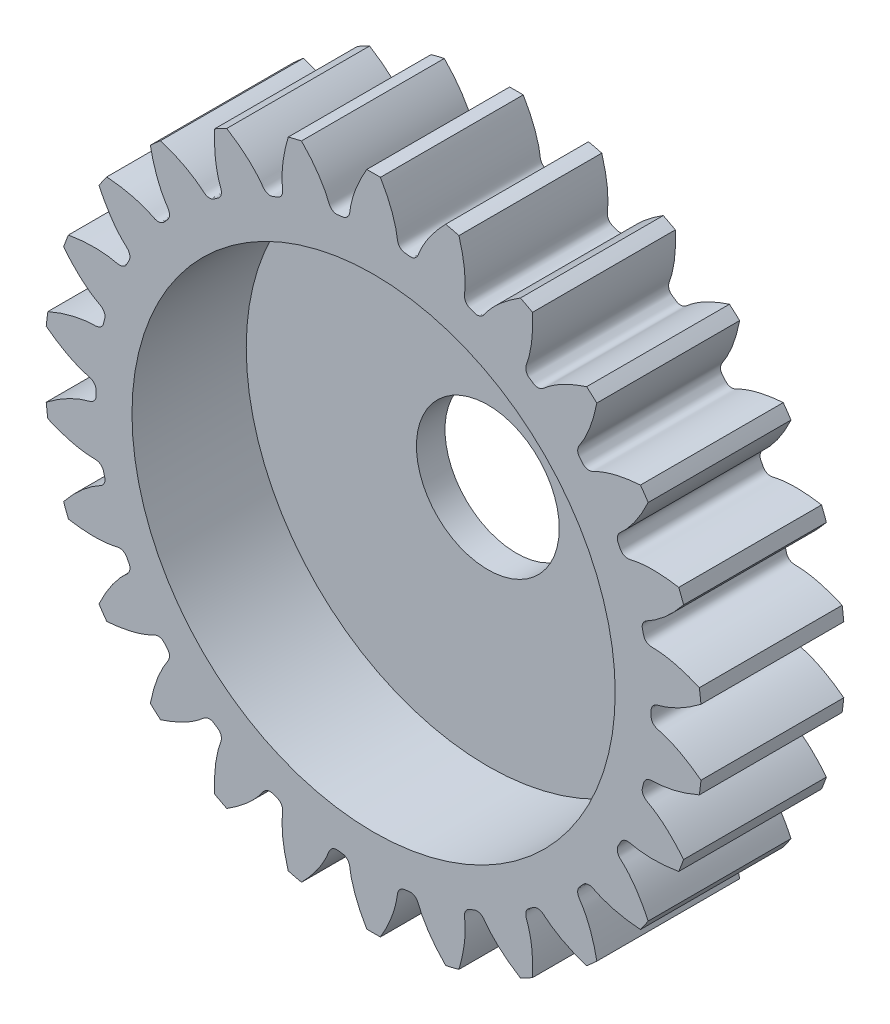
from build123d import *

# Parameters (mm, degrees)
SKETCHREVOLVESPURASSEMBLYNEW2PINION_W       = 6
SKETCHREVOLVESPURASSEMBLYNEW2PINION_H       = 13.822115385
TOOTHEXTRUDECUTSPURASSEMBLYNEW2PINION_DEPTH = 4
PATTERNSPURASSEMBLYNEW2PINION_COUNT         = 26
SKETCH_2_R                                  = 10.15
CUT_EXTRUDE_2_DEPTH                         = 4.8
SKETCH_4_R                                  = 3
CUT_EXTRUDE_3_DEPTH                         = 21.080697223


with BuildPart() as part:
    # SketchRevolveSpurAssemblyNew2Pinion → SpurAssemblyNew2Pinion (revolve)
    with BuildSketch(Plane(origin=(0, 0, 0), x_dir=(0, 0, -1), z_dir=(1, 0, 0))):
        with Locations((-1, 6.911057693)):
            Rectangle(SKETCHREVOLVESPURASSEMBLYNEW2PINION_W, SKETCHREVOLVESPURASSEMBLYNEW2PINION_H)
    revolve(axis=Axis((0, 0, 0), (0, 0, -1)))

    # SketchToothSpurAssemblyNew2Pinion → ToothExtrudeCutSpurAssemblyNew2Pinion (cut, symmetric)
    with BuildSketch(Plane.XY):
        with BuildLine():
            ThreePointArc((13.81451757, 1.428912571), (13.888221154, 0), (13.81451757, -1.428912571))
            add(Edge.make_bspline(
                [(13.81451757, -1.428912571), (13.726688541, -1.359920515), (13.595197672, -1.261341012), (13.418856258, -1.138772461), (13.292585484, -1.055332348), (13.169877801, -0.978321954), (13.050962499, -0.907526114), (12.936060688, -0.842722426), (12.825385077, -0.783681639), (12.719139799, -0.730167838), (12.617520148, -0.681938938), (12.520712627, -0.638746252), (12.428893992, -0.600337203), (12.342233738, -0.566447419), (12.260885006, -0.536828638), (12.185014321, -0.511156667), (12.114702314, -0.489338003), (12.027112004, -0.463735243), (11.954138744, -0.448230597), (11.897794168, -0.427981043), (11.875856753, -0.418994985), (11.853410983, -0.408473503), (11.830202837, -0.395946023), (11.805975271, -0.380738879), (11.780539315, -0.361904625), (11.753919073, -0.33815527), (11.726633215, -0.307873546), (11.700089703, -0.269352659), (11.677071777, -0.221496801), (11.661562379, -0.16645758), (11.656168867, -0.09130535), (11.660269272, 0), (11.656168867, 0.09130535), (11.661562379, 0.16645758), (11.677071777, 0.221496801), (11.700089703, 0.269352659), (11.726633215, 0.307873546), (11.753919073, 0.33815527), (11.780539315, 0.361904625), (11.805975271, 0.380738879), (11.830202837, 0.395946023), (11.853410983, 0.408473503), (11.875856753, 0.418994985), (11.897794168, 0.427981043), (11.954138744, 0.448230597), (12.027112004, 0.463735243), (12.114702314, 0.489338003), (12.185014321, 0.511156667), (12.260885006, 0.536828638), (12.342233738, 0.566447419), (12.428893992, 0.600337203), (12.520712627, 0.638746252), (12.617520148, 0.681938938), (12.719139799, 0.730167838), (12.825385077, 0.783681639), (12.936060688, 0.842722426), (13.050962499, 0.907526114), (13.169877801, 0.978321954), (13.292585484, 1.055332348), (13.418856258, 1.138772461), (13.595197672, 1.261341012), (13.726688541, 1.359920515), (13.81451757, 1.428912571)],
                knots=[0, 0, 0, 0, 0.061765594, 0.090857399, 0.118755208, 0.145459022, 0.170968841, 0.195284665, 0.218406493, 0.240334327, 0.261068165, 0.280608009, 0.298953857, 0.31610571, 0.332063567, 0.34682743, 0.360397297, 0.37277317, 0.397298679, 0.401522405, 0.405867911, 0.410405301, 0.415225201, 0.420444455, 0.426211586, 0.432708636, 0.440141309, 0.448702283, 0.458489871, 0.469387514, 0.480099546, 0.5, 0.519900454, 0.530612486, 0.541510129, 0.551297717, 0.559858691, 0.567291364, 0.573788414, 0.579555545, 0.584774799, 0.589594699, 0.594132089, 0.598477595, 0.602701321, 0.62722683, 0.639602703, 0.65317257, 0.667936433, 0.68389429, 0.701046143, 0.719391991, 0.738931835, 0.759665673, 0.781593507, 0.804715335, 0.829031159, 0.854540978, 0.881244792, 0.909142601, 0.938234406, 1, 1, 1, 1], degree=3))
        make_face()
    toothextrudecutspurassemblynew2pinion = extrude(amount=TOOTHEXTRUDECUTSPURASSEMBLYNEW2PINION_DEPTH, both=True, mode=Mode.SUBTRACT)

    # PatternSpurAssemblyNew2Pinion: ToothExtrudeCutSpurAssemblyNew2Pinion ×26 about axis
    patternspurassemblynew2pinion_axis = Axis((0, 0, 50), (0, 0, -1))
    for i in range(1, PATTERNSPURASSEMBLYNEW2PINION_COUNT):
        add(toothextrudecutspurassemblynew2pinion.rotate(patternspurassemblynew2pinion_axis, i * 360 / PATTERNSPURASSEMBLYNEW2PINION_COUNT), mode=Mode.SUBTRACT)

    # Эскиз2 → Вырез-Вытянуть2 (cut)
    with BuildSketch(Plane.XY.offset(4)):
        Circle(SKETCH_2_R)
    extrude(amount=-CUT_EXTRUDE_2_DEPTH, mode=Mode.SUBTRACT)

    # Эскиз4 → Вырез-Вытянуть3 (cut, through all)
    with BuildSketch(Plane.XY.offset(-0.8)):
        Circle(SKETCH_4_R)
    extrude(amount=-CUT_EXTRUDE_3_DEPTH, mode=Mode.SUBTRACT)


solid = part.part
